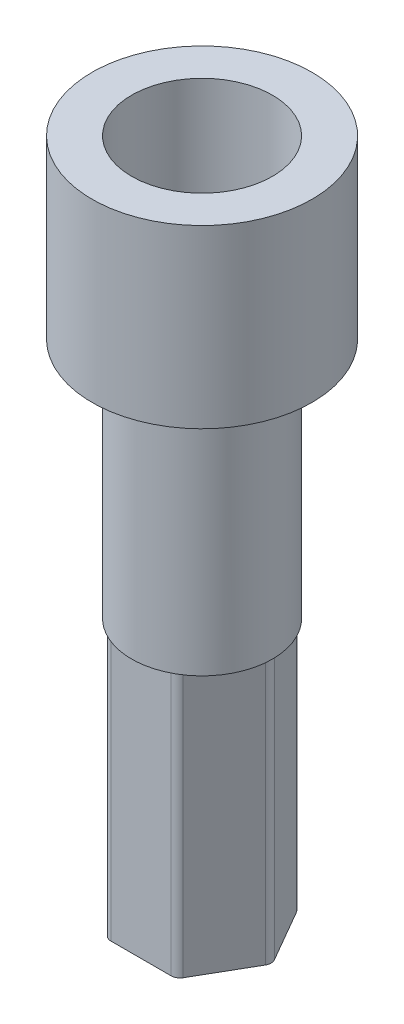
from build123d import *

# Parameters (mm, degrees)
SKETCH2_R          = 4.064
CUT_EXTRUDE1_DEPTH = 8.382
CUT_EXTRUDE3_START = -15.24
CUT_EXTRUDE3_DEPTH = 15.24
FILLET2_R          = 0.508


with BuildPart() as part:
    # Sketch1 → Revolve1 (revolve)
    with BuildSketch(Plane(origin=(0, 0, 0), x_dir=(0, 0, -1), z_dir=(1, 0, 0))):
        Polygon((0, 0), (4.064, 0), (4.064, 13.97), (4.064, 29.21), (6.35, 29.21), (6.35, 39.37), (0, 39.37), align=None)
    revolve(axis=Axis((0, 0, 0), (0, 1, 0)))

    # Sketch2 → Cut-Extrude1 (cut)
    with BuildSketch(Plane(origin=(0, 39.37, 0), x_dir=(1, 0, 0), z_dir=(0, 1, 0))):
        with Locations(Location((0, 0, 0), (0, 0, 90))):
            Circle(SKETCH2_R)
    extrude(amount=-CUT_EXTRUDE1_DEPTH, mode=Mode.SUBTRACT)

    # Sketch3 → Cut-Extrude3 (cut)
    with BuildSketch(Plane.XZ.offset(CUT_EXTRUDE3_START)):
        with BuildLine():
            Line((-2.032, 3.519527241), (2.032, 3.519527241))
            ThreePointArc((2.032, 3.519527241), (0, 4.064), (-2.032, 3.519527241))
        make_face()
        with BuildLine():
            ThreePointArc((4.064, 0), (3.519527241, 2.032), (2.032, 3.519527241))
            Line((2.032, 3.519527241), (4.064, 0))
        make_face()
        with BuildLine():
            ThreePointArc((2.032, -3.519527241), (3.519527241, -2.032), (4.064, 0))
            Line((4.064, 0), (2.032, -3.519527241))
        make_face()
        with BuildLine():
            ThreePointArc((-2.032, -3.519527241), (0, -4.064), (2.032, -3.519527241))
            Line((2.032, -3.519527241), (-2.032, -3.519527241))
        make_face()
        with BuildLine():
            Line((-2.032, -3.519527241), (-4.064, 0))
            ThreePointArc((-4.064, 0), (-3.519527241, -2.032), (-2.032, -3.519527241))
        make_face()
        with BuildLine():
            Line((-4.064, 0), (-2.032, 3.519527241))
            ThreePointArc((-2.032, 3.519527241), (-3.519527241, 2.032), (-4.064, 0))
        make_face()
    extrude(amount=CUT_EXTRUDE3_DEPTH, mode=Mode.SUBTRACT)

    # Fillet2
    fillet2_edges = [part.edges().sort_by_distance(p)[0] for p in [
        (-4.064, 7.62, 0),
        (2.032, 7.62, -3.519527241),
        (2.032, 7.62, 3.519527241),
        (-2.032, 7.62, 3.519527241),
        (4.064, 7.62, 0),
        (-2.032, 7.62, -3.519527241),
    ]]
    fillet(fillet2_edges, radius=FILLET2_R)


solid = part.part
